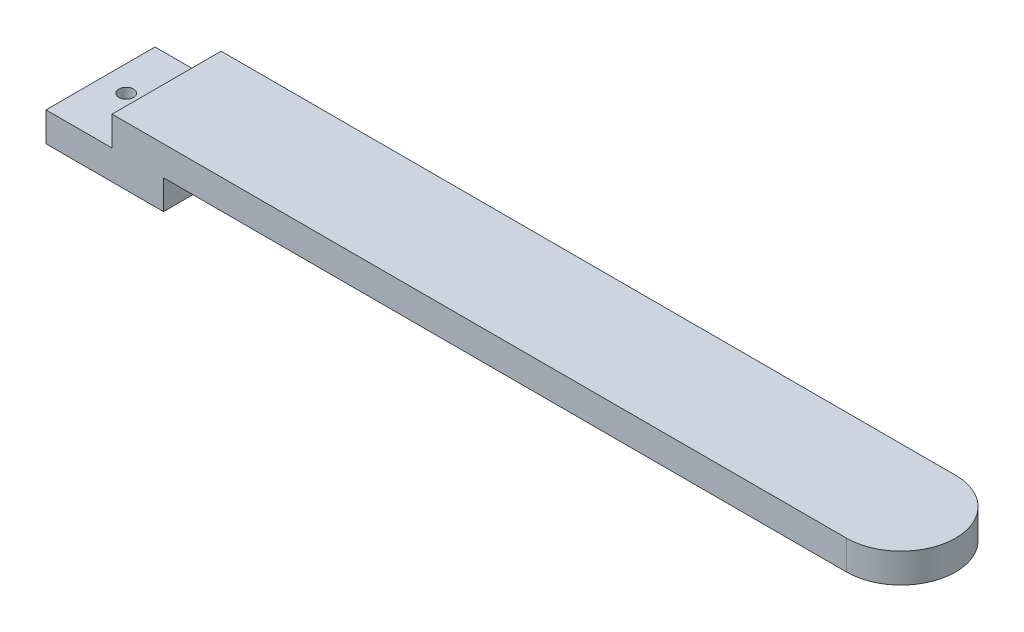
from build123d import *

# Parameters (mm, degrees)
BOSS_EXTRUDE1_DEPTH = 8
SKETCH2_W           = 32
SKETCH2_H           = 29.68
SKETCH2_R           = 2
BOSS_EXTRUDE2_DEPTH = 8


with BuildPart() as part:
    # Sketch1 → Boss-Extrude1 (new body)
    with BuildSketch(Plane(origin=(0, 0, 0), x_dir=(1, 0, 0), z_dir=(0, 1, 0))):
        with BuildLine():
            Line((0, 14.84), (200, 14.84))
            ThreePointArc((200, 14.84), (214.84, 0), (200, -14.84))
            Line((200, -14.84), (0, -14.84))
            Line((0, -14.84), (0, 14.84))
        make_face()
    extrude(amount=BOSS_EXTRUDE1_DEPTH)

    # Sketch2 → Boss-Extrude2 (add)
    with BuildSketch(Plane(origin=(0, 0, 0), x_dir=(1, 0, 0), z_dir=(0, 1, 0))):
        with Locations((-2, 0)):
            Rectangle(SKETCH2_W, SKETCH2_H)
        with Locations(Location((-11, 0, 0), (0, 0, 270))):
            Circle(SKETCH2_R, mode=Mode.SUBTRACT)
    extrude(amount=-BOSS_EXTRUDE2_DEPTH)


solid = part.part
